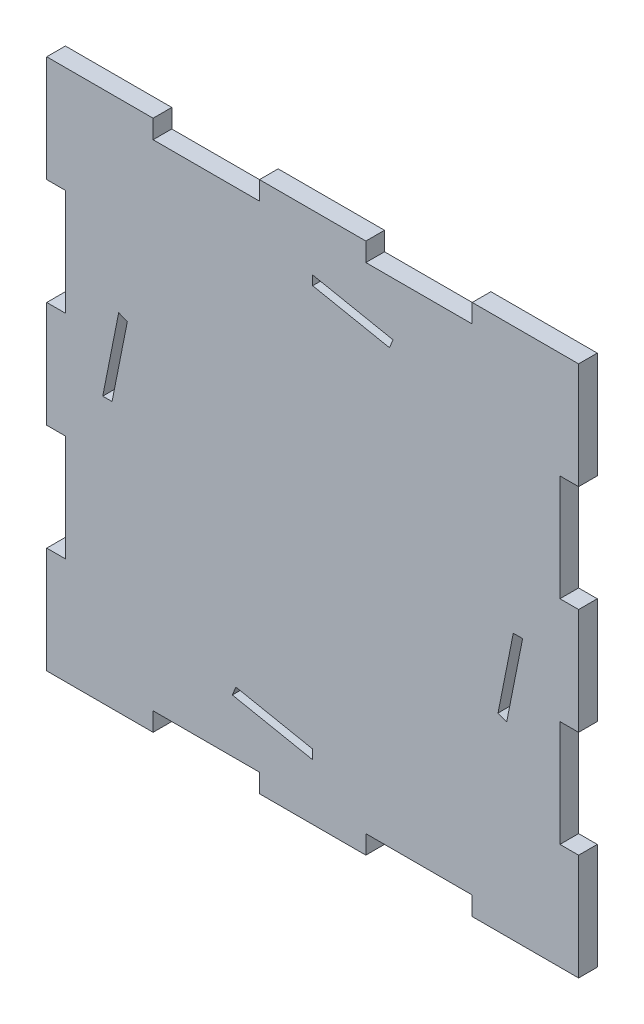
from build123d import *

# Parameters (mm, degrees)
SKETCH1_W           = 144.78
SKETCH1_H           = 144.78
BOSS_EXTRUDE1_DEPTH = 5.08
SKETCH3_W           = 5.08
SKETCH3_H           = 28.956
SKETCH3_W_2         = 28.956
SKETCH3_H_2         = 5.08
CUT_EXTRUDE1_DEPTH  = 205.812849206
CUT_EXTRUDE3_DEPTH  = 205.812849206


with BuildPart() as part:
    # Sketch1 → Boss-Extrude1 (new body)
    with BuildSketch(Plane.XY):
        with Locations((72.39, 72.39)):
            Rectangle(SKETCH1_W, SKETCH1_H)
    extrude(amount=BOSS_EXTRUDE1_DEPTH)

    # Sketch3 → Cut-Extrude1 (cut, through all)
    with BuildSketch(Plane.XY.offset(5.08)):
        with Locations((2.54, 101.346)):
            Rectangle(SKETCH3_W, SKETCH3_H)
        with Locations((2.54, 43.434)):
            Rectangle(SKETCH3_W, SKETCH3_H)
        with Locations((142.24, 101.346)):
            Rectangle(SKETCH3_W, SKETCH3_H)
        with Locations((142.24, 43.434)):
            Rectangle(SKETCH3_W, SKETCH3_H)
        with Locations((43.434, 142.24)):
            Rectangle(SKETCH3_W_2, SKETCH3_H_2)
        with Locations((101.346, 142.24)):
            Rectangle(SKETCH3_W_2, SKETCH3_H_2)
        with Locations((43.434, 2.54)):
            Rectangle(SKETCH3_W_2, SKETCH3_H_2)
        with Locations((101.346, 2.54)):
            Rectangle(SKETCH3_W_2, SKETCH3_H_2)
    extrude(amount=-CUT_EXTRUDE1_DEPTH, mode=Mode.SUBTRACT)

    # Sketch7 → Cut-Extrude3 (cut, through all)
    with BuildSketch(Plane.XY.offset(5.08)):
        Polygon((72.39, 129.54), (94.26035816, 125.189715283), (93.288342241, 122.84306127), (72.39, 127), align=None)
        Polygon((129.54, 72.39), (125.189715283, 50.51964184), (122.84306127, 51.491657759), (127, 72.39), align=None)
        Polygon((72.39, 15.24), (50.51964184, 19.590284717), (51.491657759, 21.93693873), (72.39, 17.78), align=None)
        Polygon((17.78, 72.39), (21.93693873, 93.288342241), (19.590284717, 94.26035816), (15.24, 72.39), align=None)
    extrude(amount=-CUT_EXTRUDE3_DEPTH, mode=Mode.SUBTRACT)


solid = part.part
